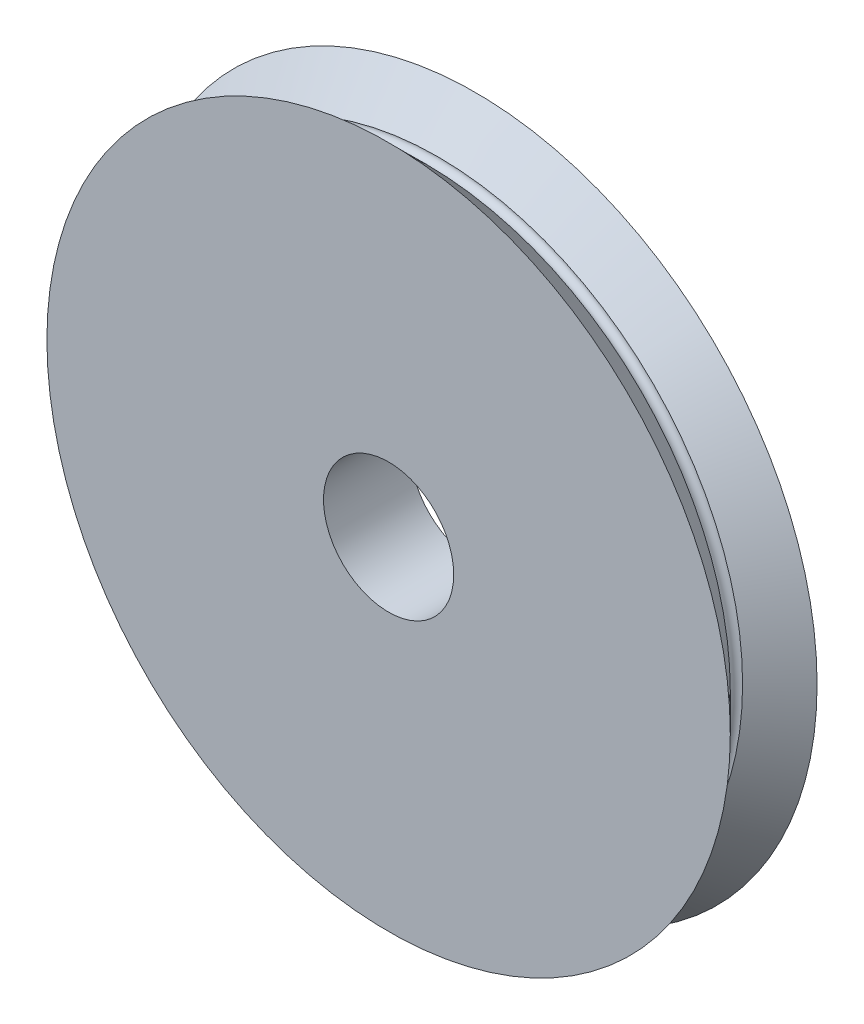
from build123d import *


with BuildPart() as part:
    # Sketch1 → Revolve1 (revolve)
    with BuildSketch(Plane(origin=(0, 0, 0), x_dir=(1, 0, 0), z_dir=(0, 1, 0))):
        with BuildLine():
            Line((9.525, 0), (9.525, 12.7))
            Line((9.525, 12.7), (50, 12.7))
            Line((50, 12.7), (44.55, 7.25))
            ThreePointArc((44.55, 7.25), (43.65, 6.35), (44.55, 5.45))
            Line((44.55, 5.45), (50, 0))
            Line((50, 0), (9.525, 0))
        make_face()
    revolve(axis=Axis((0, 0, 0), (0, 0, -1)))


solid = part.part
